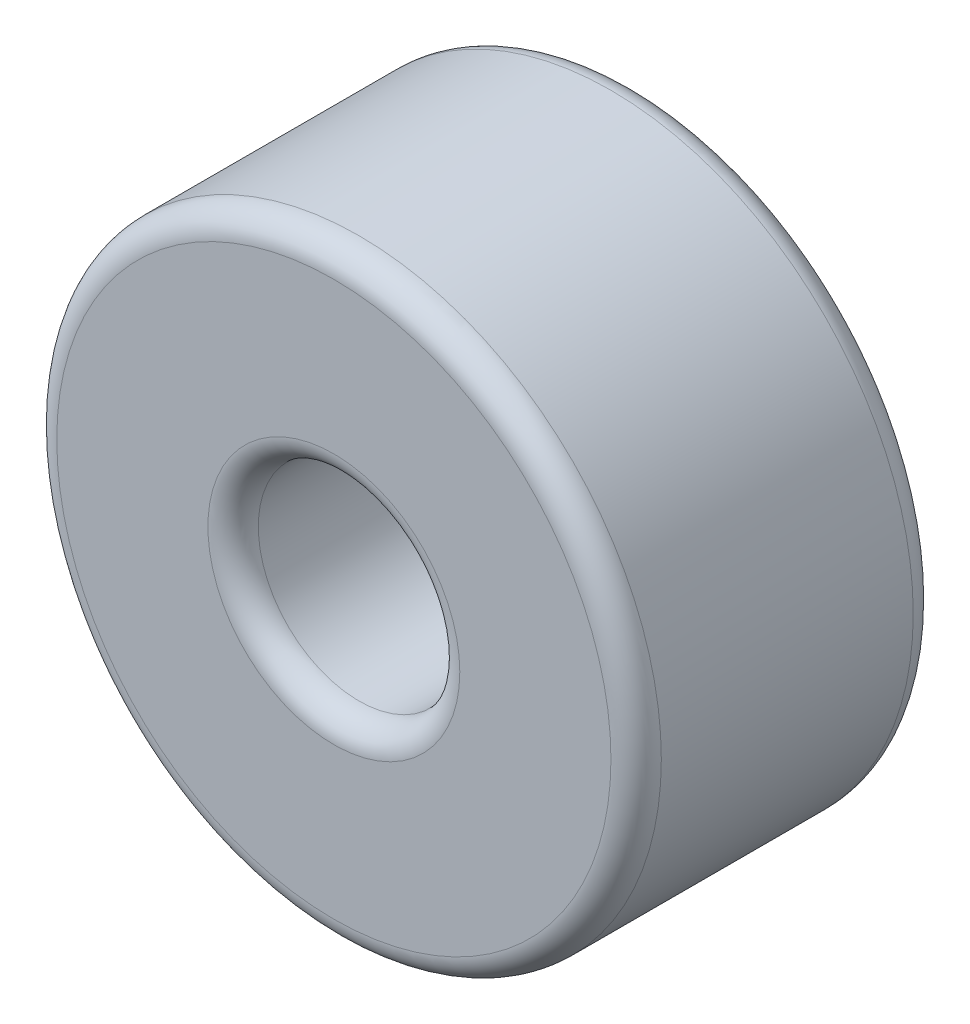
from build123d import *

# Parameters (mm, degrees)
SKETCH1_R           = 3
SKETCH1_R_2         = 1
EXTRUDE_THIN1_DEPTH = 3
FILLET1_R           = 0.25


with BuildPart() as part:
    # Sketch1 → Extrude-Thin1 (new body)
    with BuildSketch(Plane.XY):
        Circle(SKETCH1_R)
        Circle(SKETCH1_R_2, mode=Mode.SUBTRACT)
    extrude(amount=EXTRUDE_THIN1_DEPTH)

    # Fillet1
    fillet1_edges = [part.edges().sort_by_distance(p)[0] for p in [
        (-3, 0, 0),
        (-1, 0, 0),
        (-3, 0, 3),
        (-1, 0, 3),
    ]]
    fillet(fillet1_edges, radius=FILLET1_R)


solid = part.part
